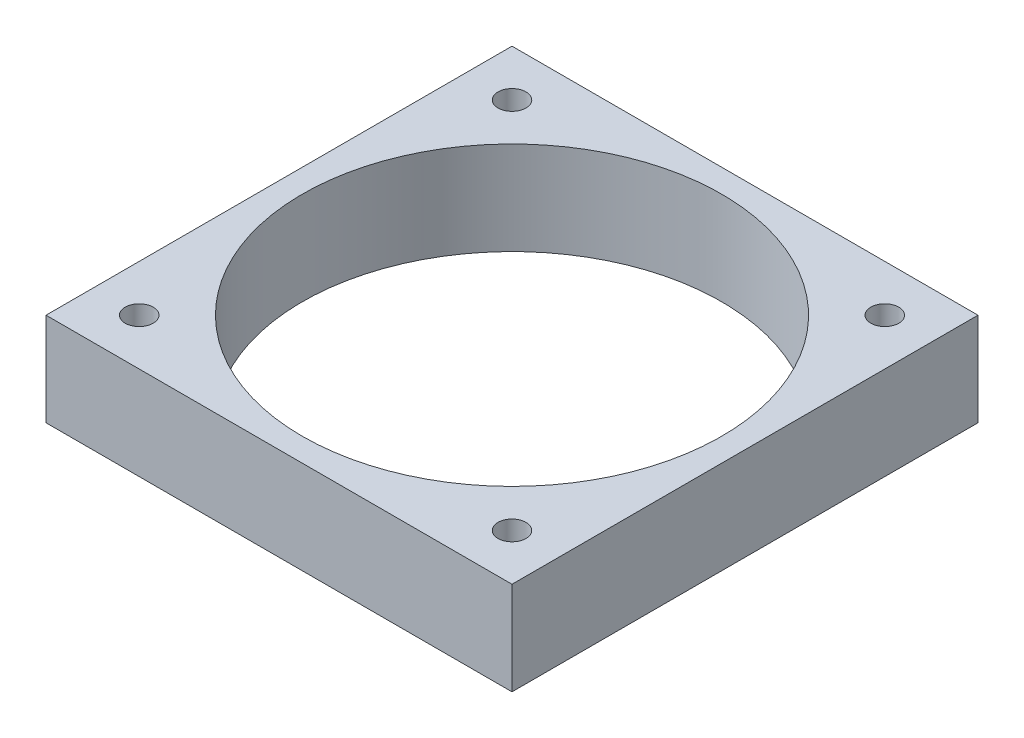
from build123d import *

# Parameters (mm, degrees)
SKETCH_1_W      = 50
SKETCH_1_H      = 50
SKETCH_1_R      = 1.5
SKETCH_1_R_2    = 22.5
EXTRUDE_1_DEPTH = 10


with BuildPart() as part:
    # 草图1 → 凸台-拉伸1 (new body)
    with BuildSketch(Plane(origin=(0, 0, 0), x_dir=(1, 0, 0), z_dir=(0, 1, 0))):
        Rectangle(SKETCH_1_W, SKETCH_1_H)
        with Locations(Location((-20, 20, 0), (0, 0, 270))):
            Circle(SKETCH_1_R, mode=Mode.SUBTRACT)
        with Locations(Location((20, 20, 0), (0, 0, 270))):
            Circle(SKETCH_1_R, mode=Mode.SUBTRACT)
        with Locations(Location((-20, -20, 0), (0, 0, 270))):
            Circle(SKETCH_1_R, mode=Mode.SUBTRACT)
        with Locations(Location((20, -20, 0), (0, 0, 270))):
            Circle(SKETCH_1_R, mode=Mode.SUBTRACT)
        with Locations(Location((0, 0, 0), (0, 0, 270))):
            Circle(SKETCH_1_R_2, mode=Mode.SUBTRACT)
    extrude(amount=EXTRUDE_1_DEPTH)


solid = part.part
